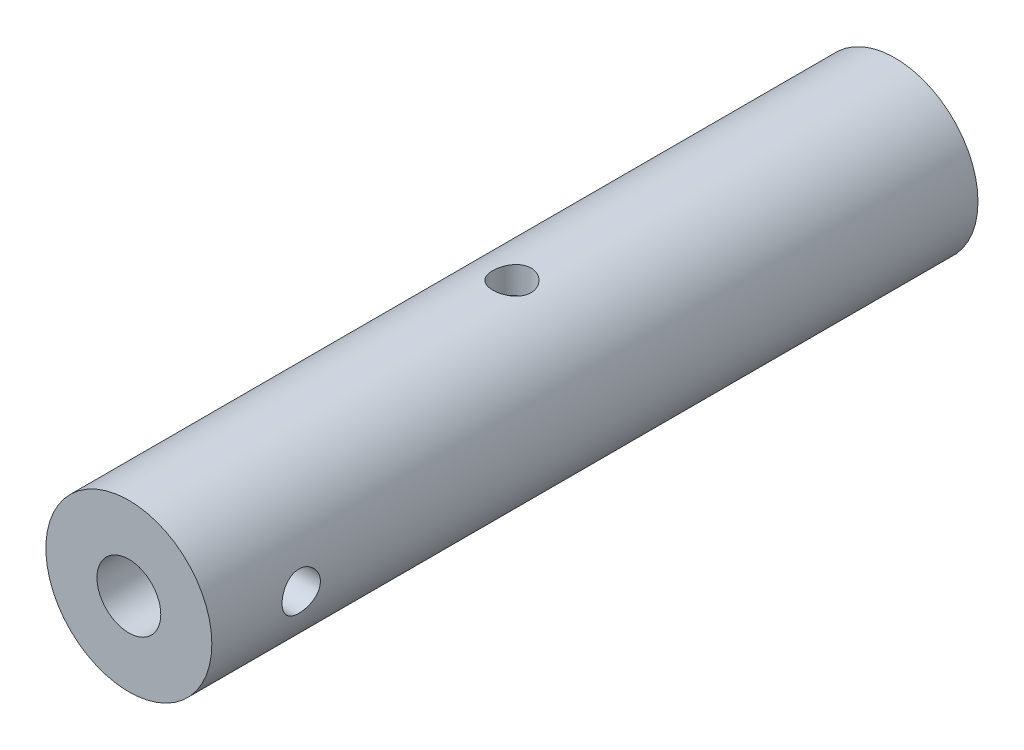
from build123d import *

# Parameters (mm, degrees)
CROQUIS1_R                 = 6.5
SALIENTE_EXTRUIR1_DEPTH    = 45
CROQUIS2_R                 = 5
CORTAR_EXTRUIR1_DEPTH      = 15
CORTAR_EXTRUIR2_REACH      = 47.929
CROQUIS4_R                 = 6.5
SALIENTE_EXTRUIR2_DEPTH    = 15
CORTAR_EXTRUIR3_REACH      = 62.7
CROQUIS5_R                 = 2.5
CORTAR_EXTRUIR4_DEPTH      = 61.700082372
CORTAR_EXTRUIR4_DEPTH_BACK = 61.700082372
CROQUIS7_R                 = 1.5
CORTAR_EXTRUIR5_DEPTH      = 61.700082493
CORTAR_EXTRUIR5_DEPTH_BACK = 61.700082493
CROQUIS8_R                 = 1.5


with BuildPart() as part:
    # Croquis1 → Saliente-Extruir1 (new body)
    with BuildSketch(Plane.XY):
        with Locations(Location((0, 0, 0), (0, 0, 180))):
            Circle(CROQUIS1_R)
    extrude(amount=SALIENTE_EXTRUIR1_DEPTH)

    # Croquis2 → Cortar-Extruir1 (cut)
    with BuildSketch(Plane(origin=(0, 0, 0), x_dir=(-1, 0, 0), z_dir=(0, 0, -1))):
        Circle(CROQUIS2_R)
    extrude(amount=-CORTAR_EXTRUIR1_DEPTH, mode=Mode.SUBTRACT)

    # Croquis3 → Cortar-Extruir2 (cut, up to next)
    with BuildSketch(Plane.XY.offset(45), mode=Mode.PRIVATE) as cortar_extruir2_sk1:
        Polygon((-5, 0), (-2.5, -4.330127019), (2.5, -4.330127019), (5, 0), (2.5, 4.330127019), (-2.5, 4.330127019), align=None)
    cortar_extruir2_tool1 = extrude(cortar_extruir2_sk1.sketch, amount=-CORTAR_EXTRUIR2_REACH, mode=Mode.PRIVATE) & part.part
    add(cortar_extruir2_tool1.solids().sort_by_distance((0, 0, 45))[0], mode=Mode.SUBTRACT)

    # Croquis4 → Saliente-Extruir2 (add)
    with BuildSketch(Plane.XY.offset(45)):
        with Locations(Location((0, 0, 0), (0, 0, 180))):
            Circle(CROQUIS4_R)
    extrude(amount=SALIENTE_EXTRUIR2_DEPTH)

    # Croquis5 → Cortar-Extruir3 (cut, up to next)
    with BuildSketch(Plane.XY.offset(60), mode=Mode.PRIVATE) as cortar_extruir3_sk1:
        Circle(CROQUIS5_R)
    cortar_extruir3_tool1 = extrude(cortar_extruir3_sk1.sketch, amount=-CORTAR_EXTRUIR3_REACH, mode=Mode.PRIVATE) & part.part
    add(cortar_extruir3_tool1.solids().sort_by_distance((0, 0, 60))[0], mode=Mode.SUBTRACT)

    # Croquis7 → Cortar-Extruir4 (cut, two sides: drawn at the far end of the back side and taken through both)
    with BuildSketch(Plane(origin=(0, 0, 0), x_dir=(0, 0, -1), z_dir=(1, 0, 0)).offset(-CORTAR_EXTRUIR4_DEPTH_BACK)):
        with Locations((-53, 0)):
            Circle(CROQUIS7_R)
    extrude(amount=CORTAR_EXTRUIR4_DEPTH + CORTAR_EXTRUIR4_DEPTH_BACK, mode=Mode.SUBTRACT)

    # Croquis8 → Cortar-Extruir5 (cut, two sides: drawn at the far end of the back side and taken through both)
    with BuildSketch(Plane(origin=(0, 0, 0), x_dir=(1, 0, 0), z_dir=(0, 1, 0)).offset(-CORTAR_EXTRUIR5_DEPTH_BACK)):
        with Locations(Location((0, -30, 0), (0, 0, 270))):
            Circle(CROQUIS8_R)
    extrude(amount=CORTAR_EXTRUIR5_DEPTH + CORTAR_EXTRUIR5_DEPTH_BACK, mode=Mode.SUBTRACT)


solid = part.part
